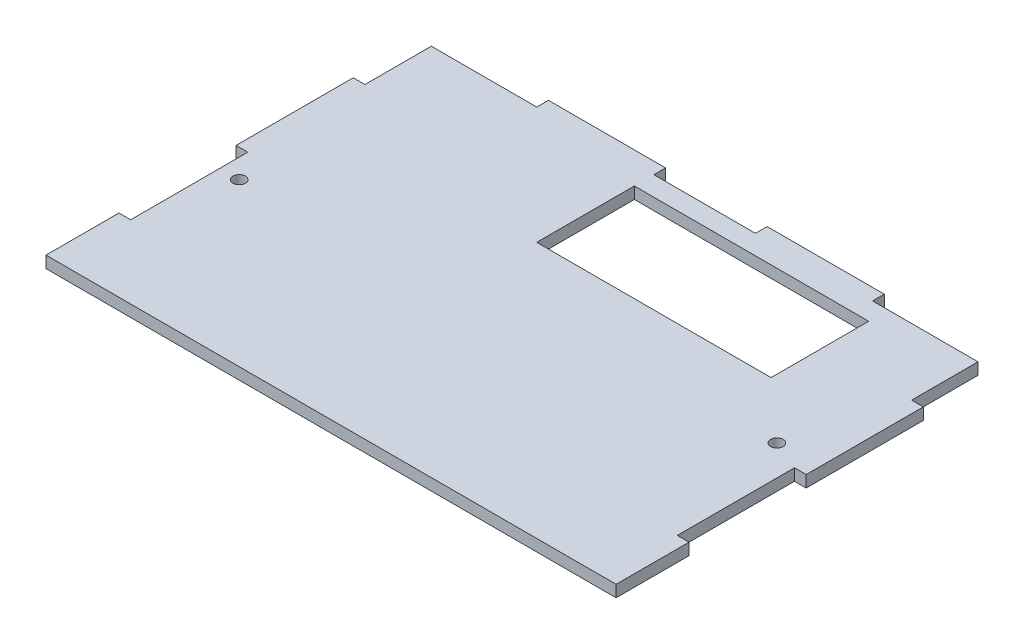
from build123d import *

# Parameters (mm, degrees)
SKETCH1_W           = 146
SKETCH1_H           = 161
BOSS_EXTRUDE1_DEPTH = 3
SKETCH2_W           = 26
SKETCH2_H           = 3
SKETCH2_W_2         = 3
SKETCH2_H_2         = 30
SKETCH2_W_3         = 60
SKETCH2_H_3         = 25
CUT_EXTRUDE1_DEPTH  = 3
SKETCH3_W           = 146
SKETCH3_H           = 62.32
CUT_EXTRUDE2_DEPTH  = 10
SKETCH4_R           = 1.6
CUT_EXTRUDE3_DEPTH  = 10


with BuildPart() as part:
    # Sketch1 → Boss-Extrude1 (new body)
    with BuildSketch(Plane(origin=(0, 0, 0), x_dir=(1, 0, 0), z_dir=(0, 1, 0))):
        Rectangle(SKETCH1_W, SKETCH1_H)
    extrude(amount=BOSS_EXTRUDE1_DEPTH)

    # Sketch2 → Cut-Extrude1 (cut)
    with BuildSketch(Plane(origin=(0, 3, 0), x_dir=(1, 0, 0), z_dir=(0, 1, 0))):
        with Locations((0, 79)):
            Rectangle(SKETCH2_W, SKETCH2_H)
        with Locations((-71.5, 15.5)):
            Rectangle(SKETCH2_W_2, SKETCH2_H_2)
        Polygon((-73, 80.5), (-73, 60.5), (-70, 60.5), (-70, 77.5), (-43, 77.5), (-43, 80.5), align=None)
        Polygon((73, 80.5), (73, 60.5), (70, 60.5), (70, 77.5), (43, 77.5), (43, 80.5), align=None)
        with Locations((71.5, 15.5)):
            Rectangle(SKETCH2_W_2, SKETCH2_H_2)
        with Locations((-71.5, -44.5)):
            Rectangle(SKETCH2_W_2, SKETCH2_H_2)
        Polygon((-70, -79.5), (-73, -79.5), (-73, -80.5), (-43, -80.5), (-43, -77.5), (-70, -77.5), align=None)
        with Locations((71.5, -44.5)):
            Rectangle(SKETCH2_W_2, SKETCH2_H_2)
        Polygon((70, -79.5), (73, -79.5), (73, -80.5), (70, -80.5), (43, -80.5), (43, -77.5), (70, -77.5), align=None)
        with Locations((0, -79)):
            Rectangle(SKETCH2_W, SKETCH2_H)
        with Locations((17, 60)):
            Rectangle(SKETCH2_W_3, SKETCH2_H_3)
    extrude(amount=-CUT_EXTRUDE1_DEPTH, mode=Mode.SUBTRACT)

    # Sketch3 → Cut-Extrude2 (cut)
    with BuildSketch(Plane(origin=(0, 0, 0), x_dir=(-1, 0, 0), z_dir=(0, -1, 0))):
        with Locations((0, -49.34)):
            Rectangle(SKETCH3_W, SKETCH3_H)
    extrude(amount=-CUT_EXTRUDE2_DEPTH, mode=Mode.SUBTRACT)

    # Sketch4 → Cut-Extrude3 (cut)
    with BuildSketch(Plane.XZ):
        with Locations(Location((62.25, -33.75, 0), (0, 0, 270))):
            Circle(SKETCH4_R)
        with Locations(Location((-65, -23.3, 0), (0, 0, 270))):
            Circle(SKETCH4_R)
    extrude(amount=-CUT_EXTRUDE3_DEPTH, mode=Mode.SUBTRACT)


solid = part.part
